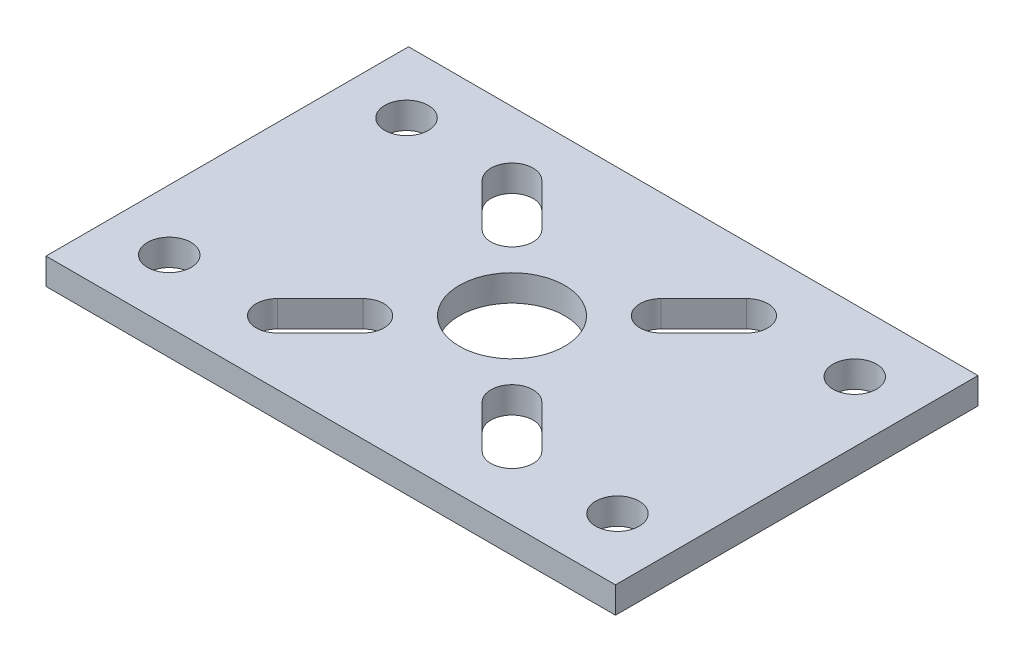
from build123d import *

# Parameters (mm, degrees)
SKETCH_1_W               = 43.2
SKETCH_1_H               = 27.5
EXTRUDE_1_DEPTH          = 2
CUT_EXTRUDE_1_REACH      = 27.683
SKETCH_2_R               = 1.65
CUT_EXTRUDE_2_REACH      = 27.683
MIRROR_2_COPY_1_REACH    = 27.683
MIRROR_2_COPY_1_SKETCH_R = 1.65
MIRROR_2_COPY_2_REACH    = 27.683
CUT_EXTRUDE_3_REACH      = 27.683
SKETCH_4_R               = 4


with BuildPart() as part:
    # 草图1 → 凸台-拉伸1 (new body)
    with BuildSketch(Plane(origin=(0, 0, 0), x_dir=(1, 0, 0), z_dir=(0, 1, 0))):
        Rectangle(SKETCH_1_W, SKETCH_1_H)
    extrude(amount=EXTRUDE_1_DEPTH)

    # 草图2 → 切除-拉伸1 (cut, up to next)
    with BuildSketch(Plane(origin=(0, 2, 0), x_dir=(1, 0, 0), z_dir=(0, 1, 0)), mode=Mode.PRIVATE) as cut_extrude_1_sk1:
        with Locations(Location((-17, 9, 0), (0, 0, 270))):
            Circle(SKETCH_2_R)
    cut_extrude_1_tool1 = extrude(cut_extrude_1_sk1.sketch, amount=-CUT_EXTRUDE_1_REACH, mode=Mode.PRIVATE) & part.part
    cut_extrude_1 = cut_extrude_1_tool1.solids().sort_by_distance((-17, 2, -9))[0]
    add(cut_extrude_1, mode=Mode.SUBTRACT)

    # 草图3 → 切除-拉伸2 (cut, up to next)
    with BuildSketch(Plane(origin=(0, 2, 0), x_dir=(1, 0, 0), z_dir=(0, 1, 0)), mode=Mode.PRIVATE) as cut_extrude_2_sk1:
        with BuildLine():
            Line((-6.788225099, 4.5254834), (-10.033845225, 7.771103525))
            ThreePointArc((-10.033845225, 7.771103525), (-10.033845225, 10.033845225), (-7.771103525, 10.033845225))
            Line((-7.771103525, 10.033845225), (-4.5254834, 6.788225099))
            ThreePointArc((-4.5254834, 6.788225099), (-4.5254834, 4.5254834), (-6.788225099, 4.5254834))
        make_face()
    cut_extrude_2_tool1 = extrude(cut_extrude_2_sk1.sketch, amount=-CUT_EXTRUDE_2_REACH, mode=Mode.PRIVATE) & part.part
    cut_extrude_2 = cut_extrude_2_tool1.solids().sort_by_distance((-7.279664, 2, -7.279664))[0]
    add(cut_extrude_2, mode=Mode.SUBTRACT)

    # 镜向1: 切除-拉伸1, 切除-拉伸2 across plane
    add(cut_extrude_1.mirror(Plane.XY), mode=Mode.SUBTRACT)
    add(cut_extrude_2.mirror(Plane.XY), mode=Mode.SUBTRACT)

    # 镜向2: 切除-拉伸1, 切除-拉伸2 across plane
    add(cut_extrude_1.mirror(Plane(origin=(0, 0, 0), x_dir=(0, 0, 1), z_dir=(1, 0, 0))), mode=Mode.SUBTRACT)
    add(cut_extrude_2.mirror(Plane(origin=(0, 0, 0), x_dir=(0, 0, 1), z_dir=(1, 0, 0))), mode=Mode.SUBTRACT)

    # 镜向2 copy 1 sketch → 镜向2 copy 1 (cut, up to next)
    with BuildSketch(Plane(origin=(0, 2, 0), x_dir=(-1, 0, 0), z_dir=(0, 1, 0)), mode=Mode.PRIVATE) as mirror_2_copy_1_sk1:
        with Locations(Location((-17, 9, 0), (0, 0, 270))):
            Circle(MIRROR_2_COPY_1_SKETCH_R)
    mirror_2_copy_1_tool1 = extrude(mirror_2_copy_1_sk1.sketch, amount=-MIRROR_2_COPY_1_REACH, mode=Mode.PRIVATE) & part.part
    add(mirror_2_copy_1_tool1.solids().sort_by_distance((17, 2, 9))[0], mode=Mode.SUBTRACT)

    # 镜向2 copy 2 sketch → 镜向2 copy 2 (cut, up to next)
    with BuildSketch(Plane(origin=(0, 2, 0), x_dir=(-1, 0, 0), z_dir=(0, 1, 0)), mode=Mode.PRIVATE) as mirror_2_copy_2_sk1:
        with BuildLine():
            Line((-6.788225099, 4.5254834), (-10.033845225, 7.771103525))
            ThreePointArc((-10.033845225, 7.771103525), (-10.033845225, 10.033845225), (-7.771103525, 10.033845225))
            Line((-7.771103525, 10.033845225), (-4.5254834, 6.788225099))
            ThreePointArc((-4.5254834, 6.788225099), (-4.5254834, 4.5254834), (-6.788225099, 4.5254834))
        make_face()
    mirror_2_copy_2_tool1 = extrude(mirror_2_copy_2_sk1.sketch, amount=-MIRROR_2_COPY_2_REACH, mode=Mode.PRIVATE) & part.part
    add(mirror_2_copy_2_tool1.solids().sort_by_distance((7.279664, 2, 7.279664))[0], mode=Mode.SUBTRACT)

    # 草图4 → 切除-拉伸3 (cut, up to next)
    with BuildSketch(Plane(origin=(0, 2, 0), x_dir=(1, 0, 0), z_dir=(0, 1, 0)), mode=Mode.PRIVATE) as cut_extrude_3_sk1:
        with Locations(Location((0, 0, 0), (0, 0, 270))):
            Circle(SKETCH_4_R)
    cut_extrude_3_tool1 = extrude(cut_extrude_3_sk1.sketch, amount=-CUT_EXTRUDE_3_REACH, mode=Mode.PRIVATE) & part.part
    add(cut_extrude_3_tool1.solids().sort_by_distance((0, 2, 0))[0], mode=Mode.SUBTRACT)


solid = part.part
